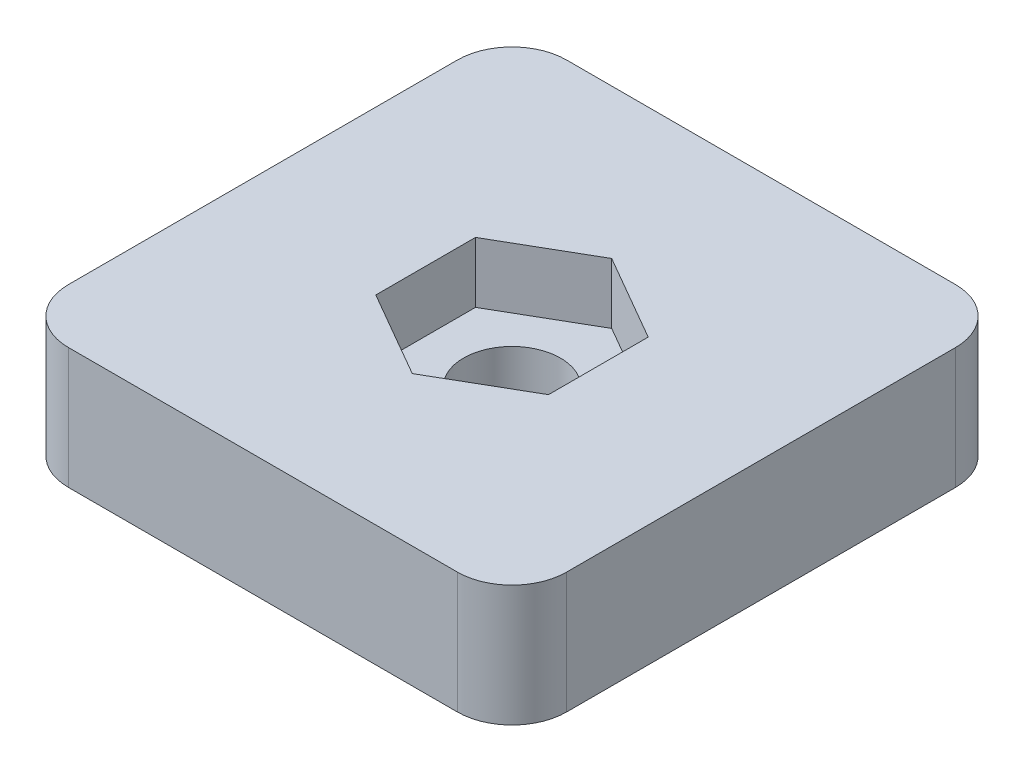
from build123d import *

# Parameters (mm, degrees)
EXTRUDE_5_DEPTH = 2
EXTRUDE_START   = -2
SKETCH_1_7_R    = 1.6
EXTRUDE_6_DEPTH = 2


with BuildPart() as part:
    # 草图1 → 凸台-拉伸5 (new body)
    with BuildSketch(Plane(origin=(0, 0, 0), x_dir=(1, 0, 0), z_dir=(0, 1, 0))):
        with BuildLine():
            Line((-8.22, 6.42), (-8.22, -6.42))
            ThreePointArc((-8.22, -6.42), (-7.692792206, -7.692792206), (-6.42, -8.22))
            Line((-6.42, -8.22), (6.42, -8.22))
            ThreePointArc((6.42, -8.22), (7.692792206, -7.692792206), (8.22, -6.42))
            Line((8.22, -6.42), (8.22, 6.42))
            ThreePointArc((8.22, 6.42), (7.692792206, 7.692792206), (6.42, 8.22))
            Line((6.42, 8.22), (-6.42, 8.22))
            ThreePointArc((-6.42, 8.22), (-7.692792206, 7.692792206), (-8.22, 6.42))
        make_face()
        Polygon((2.85, -1.645448267), (0, -3.290896534), (-2.85, -1.645448267), (-2.85, 1.645448267), (0, 3.290896534), (2.85, 1.645448267), align=None, mode=Mode.SUBTRACT)
    extrude(amount=EXTRUDE_5_DEPTH)

    # 草图1<7> → 凸台-拉伸6 (add)
    with BuildSketch(Plane(origin=(0, 0, 0), x_dir=(1, 0, 0), z_dir=(0, 1, 0)).offset(EXTRUDE_START)):
        with BuildLine():
            Line((-8.22, 6.42), (-8.22, -6.42))
            ThreePointArc((-8.22, -6.42), (-7.692792206, -7.692792206), (-6.42, -8.22))
            Line((-6.42, -8.22), (6.42, -8.22))
            ThreePointArc((6.42, -8.22), (7.692792206, -7.692792206), (8.22, -6.42))
            Line((8.22, -6.42), (8.22, 6.42))
            ThreePointArc((8.22, 6.42), (7.692792206, 7.692792206), (6.42, 8.22))
            Line((6.42, 8.22), (-6.42, 8.22))
            ThreePointArc((-6.42, 8.22), (-7.692792206, 7.692792206), (-8.22, 6.42))
        make_face()
        Circle(SKETCH_1_7_R, mode=Mode.SUBTRACT)
    extrude(amount=EXTRUDE_6_DEPTH)


solid = part.part
